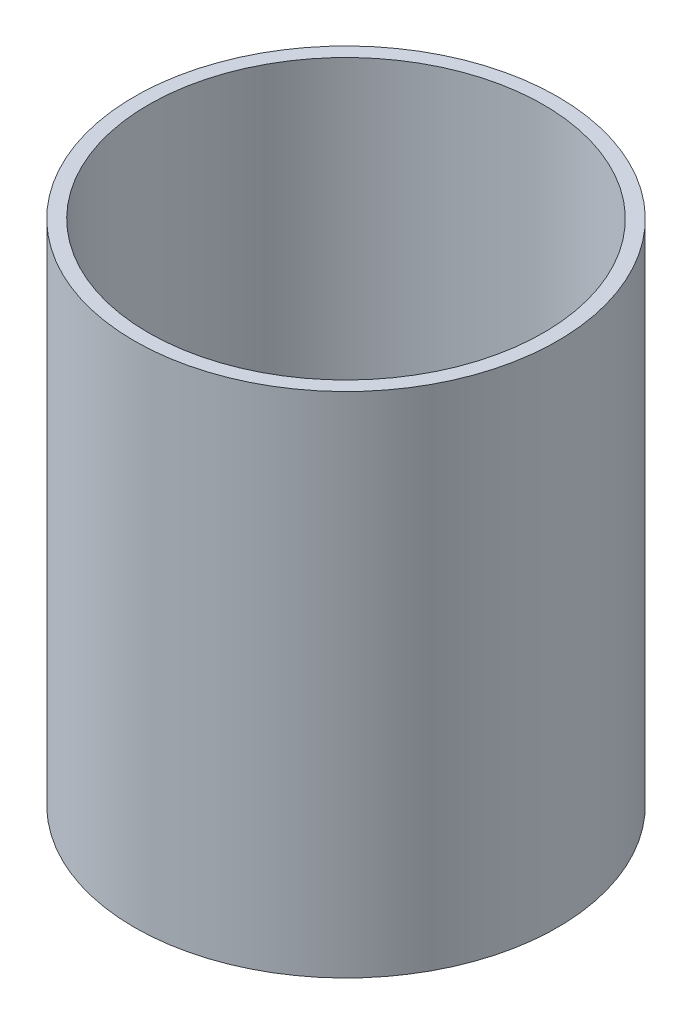
from build123d import *

# Parameters (mm, degrees)
CROQUIS1_R              = 150
SALIENTE_EXTRUIR1_DEPTH = 360
CROQUIS2_R              = 140
CORTAR_EXTRUIR1_DEPTH   = 350


with BuildPart() as part:
    # Croquis1 → Saliente-Extruir1 (new body)
    with BuildSketch(Plane(origin=(0, 0, 0), x_dir=(1, 0, 0), z_dir=(0, 1, 0))):
        with Locations(Location((0, 0, 0), (0, 0, 90))):
            Circle(CROQUIS1_R)
    extrude(amount=SALIENTE_EXTRUIR1_DEPTH)

    # Croquis2 → Cortar-Extruir1 (cut)
    with BuildSketch(Plane(origin=(0, 360, 0), x_dir=(1, 0, 0), z_dir=(0, 1, 0))):
        with Locations(Location((0, 0, 0), (0, 0, 270))):
            Circle(CROQUIS2_R)
    extrude(amount=-CORTAR_EXTRUIR1_DEPTH, mode=Mode.SUBTRACT)


solid = part.part
